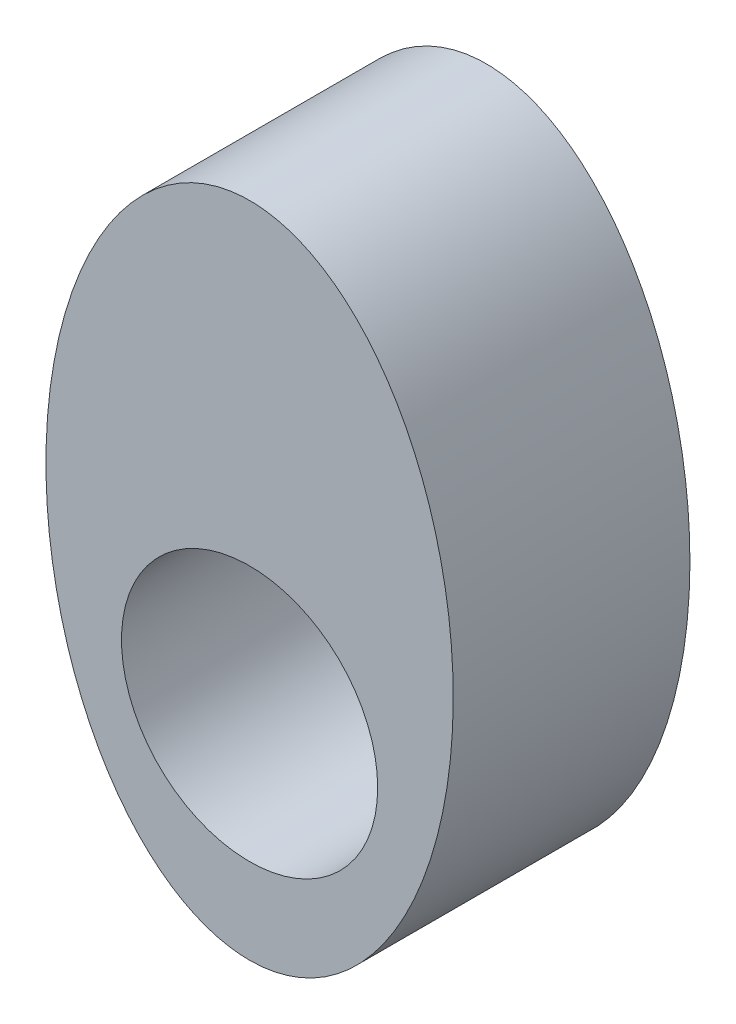
from build123d import *

# Parameters (mm, degrees)
SKETCH2_RX          = 12.232758564
SKETCH2_RY          = 7.571078701
SKETCH2_R           = 4.7625
BOSS_EXTRUDE1_DEPTH = 8.80000018


with BuildPart() as part:
    # Sketch2 → Boss-Extrude1 (new body)
    with BuildSketch(Plane.XY):
        with Locations(Location((0, 4.295258564), (0, 0, -90))):
            Ellipse(SKETCH2_RX, SKETCH2_RY)
        Circle(SKETCH2_R, mode=Mode.SUBTRACT)
    extrude(amount=BOSS_EXTRUDE1_DEPTH)


solid = part.part
